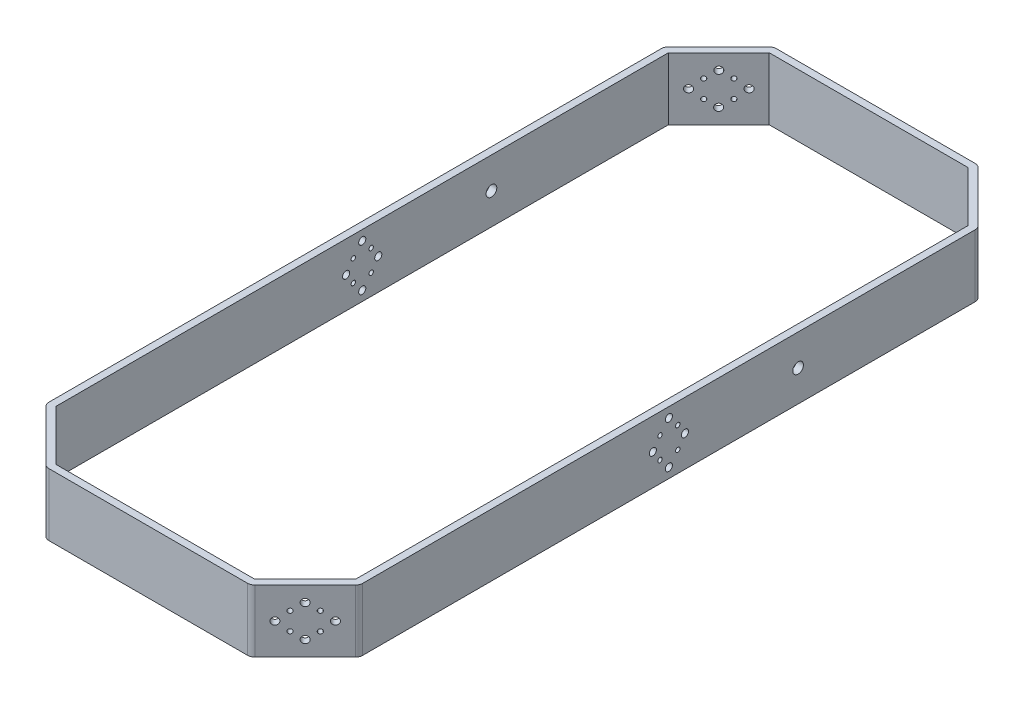
from build123d import *

# Parameters (mm, degrees)
Y_KSEKLIK_EKSTR_ZYON1_DEPTH = 35
KES_EKSTR_ZYON1_DEPTH       = 269
IZIM3_R                     = 2
IZIM3_R_2                   = 1.25
KES_EKSTR_ZYON2_DEPTH       = 10
IZIM4_R                     = 2
IZIM4_R_2                   = 1.25
KES_EKSTR_ZYON3_DEPTH       = 10
IZIM5_R                     = 1.25
IZIM5_R_2                   = 2
KES_EKSTR_ZYON4_DEPTH       = 77
IZIM6_R                     = 1.25
IZIM6_R_2                   = 2
KES_EKSTR_ZYON5_DEPTH       = 77
IZIM7_R                     = 2
IZIM7_R_2                   = 1.25
KES_EKSTR_ZYON6_DEPTH       = 382
IZIM8_R                     = 2
IZIM8_R_2                   = 1.25
Y_KSEKLIK_EKSTR_ZYON3_DEPTH = 4
Y_KSEKLIK_EKSTR_ZYON4_START = -4
IZIM9_R                     = 2
IZIM9_R_2                   = 1.25
Y_KSEKLIK_EKSTR_ZYON4_DEPTH = 4
IZIM10_R                    = 2
IZIM10_R_2                  = 1.25
KES_EKSTR_ZYON8_DEPTH       = 228


with BuildPart() as part:
    # Çizim1 → Yükseklik-Ekstrüzyon1 (new body)
    with BuildSketch(Plane(origin=(0, 0, 0), x_dir=(1, 0, 0), z_dir=(0, 1, 0))):
        with BuildLine():
            Line((142.544155877, -2.828427125), (170.828427125, 25.455844123))
            ThreePointArc((170.828427125, 25.455844123), (171.69551813, 26.753537518), (172, 28.284271247))
            Line((172, 28.284271247), (172, 371.715728753))
            ThreePointArc((172, 371.715728753), (171.69551813, 373.246462482), (170.828427125, 374.544155877))
            Line((170.828427125, 374.544155877), (142.544155877, 402.828427125))
            ThreePointArc((142.544155877, 402.828427125), (141.246462482, 403.69551813), (139.715728753, 404))
            Line((139.715728753, 404), (28.284271247, 404))
            ThreePointArc((28.284271247, 404), (26.753537518, 403.69551813), (25.455844123, 402.828427125))
            Line((25.455844123, 402.828427125), (-2.828427125, 374.544155877))
            ThreePointArc((-2.828427125, 374.544155877), (-3.69551813, 373.246462482), (-4, 371.715728753))
            Line((-4, 371.715728753), (-4, 28.284271247))
            ThreePointArc((-4, 28.284271247), (-3.69551813, 26.753537518), (-2.828427125, 25.455844123))
            Line((-2.828427125, 25.455844123), (25.455844123, -2.828427125))
            ThreePointArc((25.455844123, -2.828427125), (26.753537518, -3.69551813), (28.284271247, -4))
            Line((28.284271247, -4), (139.715728753, -4))
            ThreePointArc((139.715728753, -4), (141.246462482, -3.69551813), (142.544155877, -2.828427125))
        make_face()
        Polygon((28.284271247, 0), (139.715728753, 0), (168, 28.284271247), (168, 371.715728753), (139.715728753, 400), (28.284271247, 400), (0, 371.715728753), (0, 28.284271247), align=None, mode=Mode.SUBTRACT)
    extrude(amount=Y_KSEKLIK_EKSTR_ZYON1_DEPTH)

    # Çizim2 → Kes-Ekstrüzyon1 (cut)
    with BuildSketch(Plane(origin=(172, 0, 0), x_dir=(0, 0, -1), z_dir=(1, 0, 0))):
        with BuildLine():
            ThreePointArc((275.468296909, 17.5), (275.456881004, 17.761467228), (275.422720168, 18.020944533))
            Line((275.422720168, 18.020944533), (272.468296909, 17.5))
            Line((272.468296909, 17.5), (275.422720168, 16.979055467))
            ThreePointArc((275.422720168, 16.979055467), (275.456881004, 17.238532772), (275.468296909, 17.5))
        make_face()
        with BuildLine():
            Line((272.468296909, 17.5), (275.422720168, 18.020944533))
            ThreePointArc((275.422720168, 18.020944533), (269.468296909, 17.5), (275.422720168, 16.979055467))
            Line((275.422720168, 16.979055467), (272.468296909, 17.5))
        make_face()
    extrude(amount=-KES_EKSTR_ZYON1_DEPTH, mode=Mode.SUBTRACT)

    # Çizim3 → Kes-Ekstrüzyon2 (cut)
    with BuildSketch(Plane(origin=(272.686291501, 0, -272.686291501), x_dir=(-0.7071067811865404, 0, -0.7071067811865547), z_dir=(0.7071067811865547, 0, -0.7071067811865404))):
        with Locations((176.048773235, 17.5)):
            Circle(IZIM3_R)
        with Locations((164.048773235, 8.5)):
            Circle(IZIM3_R)
        with Locations((164.048773235, 26.5)):
            Circle(IZIM3_R)
        with Locations((152.048773235, 17.5)):
            Circle(IZIM3_R)
        with Locations((158.048773235, 22.5)):
            Circle(IZIM3_R_2)
        with Locations((170.048773235, 22.442626722)):
            Circle(IZIM3_R_2)
        with Locations((158.048773235, 12.5)):
            Circle(IZIM3_R_2)
        with Locations((170.048773235, 12.557373278)):
            Circle(IZIM3_R_2)
    extrude(amount=-KES_EKSTR_ZYON2_DEPTH, mode=Mode.SUBTRACT)

    # Çizim4 → Kes-Ekstrüzyon3 (cut)
    with BuildSketch(Plane(origin=(-188.686291501, 0, -188.686291501), x_dir=(-0.707106781186543, 0, 0.707106781186552), z_dir=(-0.707106781186552, 0, -0.707106781186543))):
        with Locations((-270.842712475, 17.5)):
            Circle(IZIM4_R)
        with Locations((-282.842712475, 26.5)):
            Circle(IZIM4_R)
        with Locations((-282.773588044, 8.5)):
            Circle(IZIM4_R)
        with Locations((-294.842712475, 17.5)):
            Circle(IZIM4_R)
        with Locations((-288.842712475, 22.5)):
            Circle(IZIM4_R_2)
        with Locations((-276.842712475, 22.5)):
            Circle(IZIM4_R_2)
        with Locations((-288.842712475, 12.5)):
            Circle(IZIM4_R_2)
        with Locations((-276.842712475, 12.5)):
            Circle(IZIM4_R_2)
    extrude(amount=-KES_EKSTR_ZYON3_DEPTH, mode=Mode.SUBTRACT)

    # Çizim5 → Kes-Ekstrüzyon4 (cut)
    with BuildSketch(Plane(origin=(11.313708499, 0, -11.313708499), x_dir=(0.7071067811865513, 0, 0.7071067811865438), z_dir=(-0.7071067811865438, 0, 0.7071067811865513))):
        with Locations((6, 23.146313605)):
            Circle(IZIM5_R)
        with Locations((-6, 23.146313605)):
            Circle(IZIM5_R)
        with Locations((0, 27.146313605)):
            Circle(IZIM5_R_2)
        with Locations((0, 8.5)):
            Circle(IZIM5_R_2)
        with Locations((6, 12.5)):
            Circle(IZIM5_R)
        with Locations((-6, 12.5)):
            Circle(IZIM5_R)
        with Locations((10.212993677, 17.5)):
            Circle(IZIM5_R_2)
        with Locations((-11.245301358, 17.5)):
            Circle(IZIM5_R_2)
    extrude(amount=-KES_EKSTR_ZYON4_DEPTH, mode=Mode.SUBTRACT)

    # Çizim6 → Kes-Ekstrüzyon5 (cut)
    with BuildSketch(Plane(origin=(72.686291501, 0, 72.686291501), x_dir=(0.7071067811865476, 0, -0.7071067811865476), z_dir=(0.7071067811865476, 0, 0.7071067811865476))):
        with Locations((124.793939239, 12.5)):
            Circle(IZIM6_R)
        with Locations((112.793939239, 12.5)):
            Circle(IZIM6_R)
        with Locations((112.793939239, 22.5)):
            Circle(IZIM6_R)
        with Locations((118.793939239, 26.5)):
            Circle(IZIM6_R_2)
        with Locations((124.793939239, 22.5)):
            Circle(IZIM6_R)
        with Locations((130.793939239, 17.5)):
            Circle(IZIM6_R_2)
        with Locations((106.793939239, 17.5)):
            Circle(IZIM6_R_2)
        with Locations((118.793939239, 8.5)):
            Circle(IZIM6_R_2)
    extrude(amount=-KES_EKSTR_ZYON5_DEPTH, mode=Mode.SUBTRACT)

    # Çizim7 → Kes-Ekstrüzyon6 (cut)
    with BuildSketch(Plane(origin=(172, 0, 0), x_dir=(0, 0, -1), z_dir=(1, 0, 0))):
        with Locations((200, 26.5)):
            Circle(IZIM7_R)
        with Locations((194, 22.5)):
            Circle(IZIM7_R_2)
        with Locations((206, 22.5)):
            Circle(IZIM7_R_2)
        with Locations((194, 12.5)):
            Circle(IZIM7_R_2)
        with Locations((206, 12.5)):
            Circle(IZIM7_R_2)
        with Locations((200, 8.5)):
            Circle(IZIM7_R)
        with Locations((188, 17.5)):
            Circle(IZIM7_R)
        with Locations((212, 17.5)):
            Circle(IZIM7_R)
    extrude(amount=-KES_EKSTR_ZYON6_DEPTH, mode=Mode.SUBTRACT)

    # Çizim8 → Yükseklik-Ekstrüzyon3 (add)
    with BuildSketch(Plane(origin=(172, 0, 0), x_dir=(0, 0, -1), z_dir=(1, 0, 0))):
        with Locations((200, 26.5)):
            Circle(IZIM8_R)
        with Locations((206, 22.5)):
            Circle(IZIM8_R_2)
        with Locations((194, 22.5)):
            Circle(IZIM8_R_2)
        with Locations((188, 17.5)):
            Circle(IZIM8_R)
        with Locations((194, 12.5)):
            Circle(IZIM8_R_2)
        with Locations((200, 8.5)):
            Circle(IZIM8_R)
        with Locations((206, 12.5)):
            Circle(IZIM8_R_2)
        with Locations((212, 17.5)):
            Circle(IZIM8_R)
    extrude(amount=-Y_KSEKLIK_EKSTR_ZYON3_DEPTH)

    # Çizim9 → Yükseklik-Ekstrüzyon4 (add)
    with BuildSketch(Plane.ZY.offset(4).offset(Y_KSEKLIK_EKSTR_ZYON4_START)):
        with Locations((-200, 26.5)):
            Circle(IZIM9_R)
        with Locations((-194, 22.5)):
            Circle(IZIM9_R_2)
        with Locations((-206, 22.5)):
            Circle(IZIM9_R_2)
        with Locations((-212, 17.5)):
            Circle(IZIM9_R)
        with Locations((-206, 12.5)):
            Circle(IZIM9_R_2)
        with Locations((-200, 8.5)):
            Circle(IZIM9_R)
        with Locations((-194, 12.5)):
            Circle(IZIM9_R_2)
        with Locations((-188, 17.5)):
            Circle(IZIM9_R)
    extrude(amount=Y_KSEKLIK_EKSTR_ZYON4_DEPTH)

    # Çizim10 → Kes-Ekstrüzyon8 (cut)
    with BuildSketch(Plane.ZY.offset(4)):
        with Locations((-200, 29.5)):
            Circle(IZIM10_R)
        with Locations((-209, 17.5)):
            Circle(IZIM10_R)
        with Locations((-191, 17.5)):
            Circle(IZIM10_R)
        with Locations((-200, 5.5)):
            Circle(IZIM10_R)
        with Locations((-205, 23.5)):
            Circle(IZIM10_R_2)
        with Locations((-195, 23.5)):
            Circle(IZIM10_R_2)
        with Locations((-205, 11.5)):
            Circle(IZIM10_R_2)
        with Locations((-195, 11.5)):
            Circle(IZIM10_R_2)
    extrude(amount=-KES_EKSTR_ZYON8_DEPTH, mode=Mode.SUBTRACT)


solid = part.part
